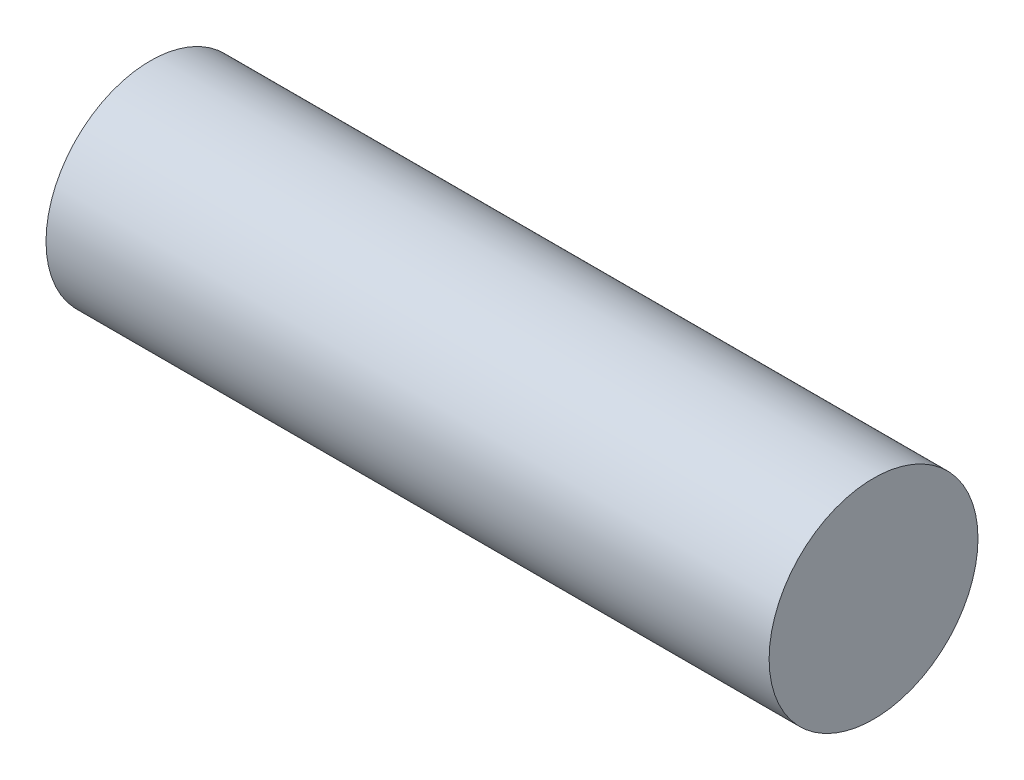
from build123d import *

# Parameters (mm, degrees)
SZKIC1_R                    = 2.6
DODANIE_WYCI_GNI_CIE1_DEPTH = 9


with BuildPart() as part:
    # Szkic1 → Dodanie-wyciągnięcie1 (new, symmetric)
    with BuildSketch(Plane(origin=(0, 0, 0), x_dir=(0, 0, -1), z_dir=(1, 0, 0))):
        Circle(SZKIC1_R)
    extrude(amount=DODANIE_WYCI_GNI_CIE1_DEPTH, both=True)


solid = part.part
